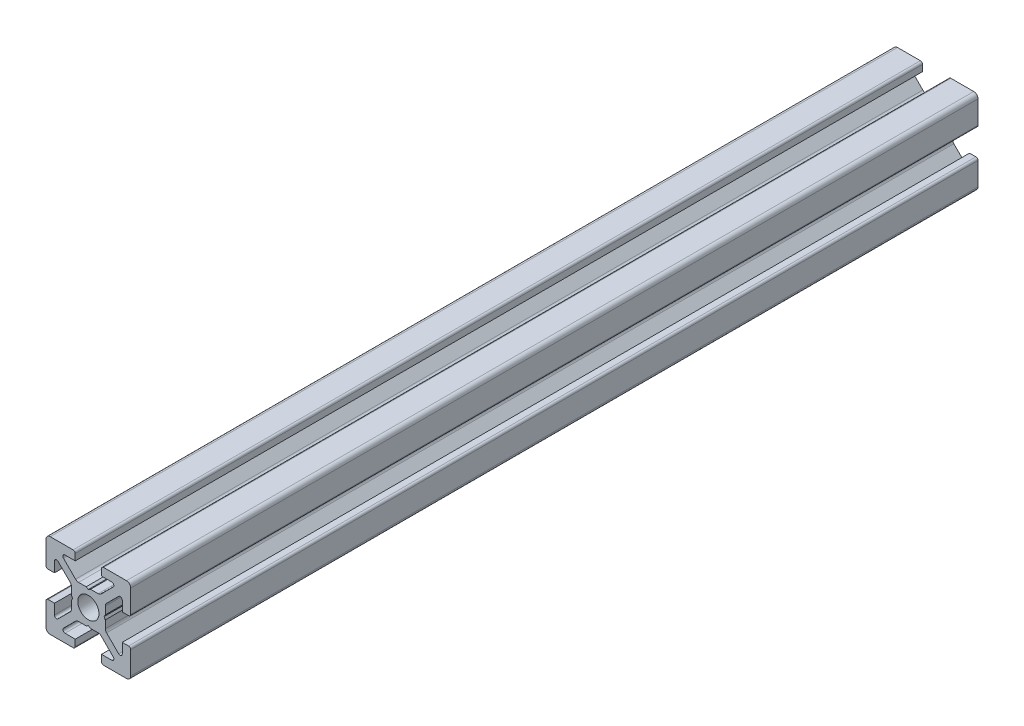
from build123d import *

# Parameters (mm, degrees)
SKETCH_1_R      = 2.5
EXTRUDE_1_DEPTH = 200


with BuildPart() as part:
    # 草图1 → 凸台-拉伸1 (new body)
    with BuildSketch(Plane.XY):
        with BuildLine():
            Line((16.486773435, 27.123343944), (19.340326826, 24.269790554))
            ThreePointArc((19.340326826, 24.269790554), (19.885221932, 24.161404178), (20.193880216, 24.623343944))
            Line((20.193880216, 24.623343944), (20.193880216, 27.043444957))
            Line((20.193880216, 27.043444957), (21.693880216, 27.043444957))
            ThreePointArc((21.693880216, 27.043444957), (22.047433607, 26.896998348), (22.193880216, 26.543444957))
            Line((22.193880216, 26.543444957), (22.193880216, 21.143444957))
            ThreePointArc((22.193880216, 21.143444957), (21.900986997, 20.436338176), (21.193880216, 20.143444957))
            Line((21.193880216, 20.143444957), (15.793880216, 20.143444957))
            ThreePointArc((15.793880216, 20.143444957), (15.440326826, 20.289891566), (15.293880216, 20.643444957))
            Line((15.293880216, 20.643444957), (15.293880216, 22.143444957))
            Line((15.293880216, 22.143444957), (17.713981229, 22.143444957))
            ThreePointArc((17.713981229, 22.143444957), (18.175920995, 22.452103241), (18.06753462, 22.996998348))
            Line((18.06753462, 22.996998348), (15.213981229, 25.850551738))
            ThreePointArc((15.213981229, 25.850551738), (14.88955788, 26.06732449), (14.506874448, 26.143444957))
            Line((14.506874448, 26.143444957), (12.713495459, 26.143444957))
            Line((12.713495459, 26.143444957), (12.193880216, 26.443444957))
            Line((12.193880216, 26.443444957), (11.674264974, 26.143444957))
            Line((11.674264974, 26.143444957), (9.880885985, 26.143444957))
            ThreePointArc((9.880885985, 26.143444957), (9.498202552, 26.06732449), (9.173779204, 25.850551738))
            Line((9.173779204, 25.850551738), (6.320225813, 22.996998348))
            ThreePointArc((6.320225813, 22.996998348), (6.211839437, 22.452103241), (6.673779204, 22.143444957))
            Line((6.673779204, 22.143444957), (9.093880216, 22.143444957))
            Line((9.093880216, 22.143444957), (9.093880216, 20.643444957))
            ThreePointArc((9.093880216, 20.643444957), (8.947433607, 20.289891566), (8.593880216, 20.143444957))
            Line((8.593880216, 20.143444957), (3.193880216, 20.143444957))
            ThreePointArc((3.193880216, 20.143444957), (2.486773435, 20.436338176), (2.193880216, 21.143444957))
            Line((2.193880216, 21.143444957), (2.193880216, 26.543444957))
            ThreePointArc((2.193880216, 26.543444957), (2.340326826, 26.896998348), (2.693880216, 27.043444957))
            Line((2.693880216, 27.043444957), (4.193880216, 27.043444957))
            Line((4.193880216, 27.043444957), (4.193880216, 24.623343944))
            ThreePointArc((4.193880216, 24.623343944), (4.5025385, 24.161404178), (5.047433607, 24.269790554))
            Line((5.047433607, 24.269790554), (7.900986997, 27.123343944))
            ThreePointArc((7.900986997, 27.123343944), (8.117759749, 27.447767293), (8.193880216, 27.830450726))
            Line((8.193880216, 27.830450726), (8.193880216, 29.623829715))
            Line((8.193880216, 29.623829715), (8.493880216, 30.143444957))
            Line((8.493880216, 30.143444957), (8.193880216, 30.663060199))
            Line((8.193880216, 30.663060199), (8.193880216, 32.456439189))
            ThreePointArc((8.193880216, 32.456439189), (8.117759749, 32.839122621), (7.900986997, 33.16354597))
            Line((7.900986997, 33.16354597), (5.047433607, 36.01709936))
            ThreePointArc((5.047433607, 36.01709936), (4.5025385, 36.125485736), (4.193880216, 35.66354597))
            Line((4.193880216, 35.66354597), (4.193880216, 33.243444957))
            Line((4.193880216, 33.243444957), (2.693880216, 33.243444957))
            ThreePointArc((2.693880216, 33.243444957), (2.340326826, 33.389891566), (2.193880216, 33.743444957))
            Line((2.193880216, 33.743444957), (2.193880216, 39.143444957))
            ThreePointArc((2.193880216, 39.143444957), (2.486773435, 39.850551738), (3.193880216, 40.143444957))
            Line((3.193880216, 40.143444957), (8.593880216, 40.143444957))
            ThreePointArc((8.593880216, 40.143444957), (8.947433607, 39.996998348), (9.093880216, 39.643444957))
            Line((9.093880216, 39.643444957), (9.093880216, 38.143444957))
            Line((9.093880216, 38.143444957), (6.673779204, 38.143444957))
            ThreePointArc((6.673779204, 38.143444957), (6.211839437, 37.834786673), (6.320225813, 37.289891566))
            Line((6.320225813, 37.289891566), (9.173779204, 34.436338176))
            ThreePointArc((9.173779204, 34.436338176), (9.498202552, 34.219565425), (9.880885985, 34.143444957))
            Line((9.880885985, 34.143444957), (11.674264974, 34.143444957))
            Line((11.674264974, 34.143444957), (12.193880216, 33.843444957))
            Line((12.193880216, 33.843444957), (12.713495459, 34.143444957))
            Line((12.713495459, 34.143444957), (14.506874448, 34.143444957))
            ThreePointArc((14.506874448, 34.143444957), (14.88955788, 34.219565425), (15.213981229, 34.436338176))
            Line((15.213981229, 34.436338176), (18.06753462, 37.289891566))
            ThreePointArc((18.06753462, 37.289891566), (18.175920995, 37.834786673), (17.713981229, 38.143444957))
            Line((17.713981229, 38.143444957), (15.293880216, 38.143444957))
            Line((15.293880216, 38.143444957), (15.293880216, 39.643444957))
            ThreePointArc((15.293880216, 39.643444957), (15.440326826, 39.996998348), (15.793880216, 40.143444957))
            Line((15.793880216, 40.143444957), (21.193880216, 40.143444957))
            ThreePointArc((21.193880216, 40.143444957), (21.900986997, 39.850551738), (22.193880216, 39.143444957))
            Line((22.193880216, 39.143444957), (22.193880216, 33.743444957))
            ThreePointArc((22.193880216, 33.743444957), (22.047433607, 33.389891566), (21.693880216, 33.243444957))
            Line((21.693880216, 33.243444957), (20.193880216, 33.243444957))
            Line((20.193880216, 33.243444957), (20.193880216, 35.66354597))
            ThreePointArc((20.193880216, 35.66354597), (19.885221932, 36.125485736), (19.340326826, 36.01709936))
            Line((19.340326826, 36.01709936), (16.486773435, 33.16354597))
            ThreePointArc((16.486773435, 33.16354597), (16.270000684, 32.839122621), (16.193880216, 32.456439189))
            Line((16.193880216, 32.456439189), (16.193880216, 30.663060199))
            Line((16.193880216, 30.663060199), (15.893880216, 30.143444957))
            Line((15.893880216, 30.143444957), (16.193880216, 29.623829715))
            Line((16.193880216, 29.623829715), (16.193880216, 27.830450726))
            ThreePointArc((16.193880216, 27.830450726), (16.270000684, 27.447767293), (16.486773435, 27.123343944))
        make_face()
        with Locations((12.193880216, 30.143444957)):
            Circle(SKETCH_1_R, mode=Mode.SUBTRACT)
    extrude(amount=EXTRUDE_1_DEPTH)


solid = part.part
